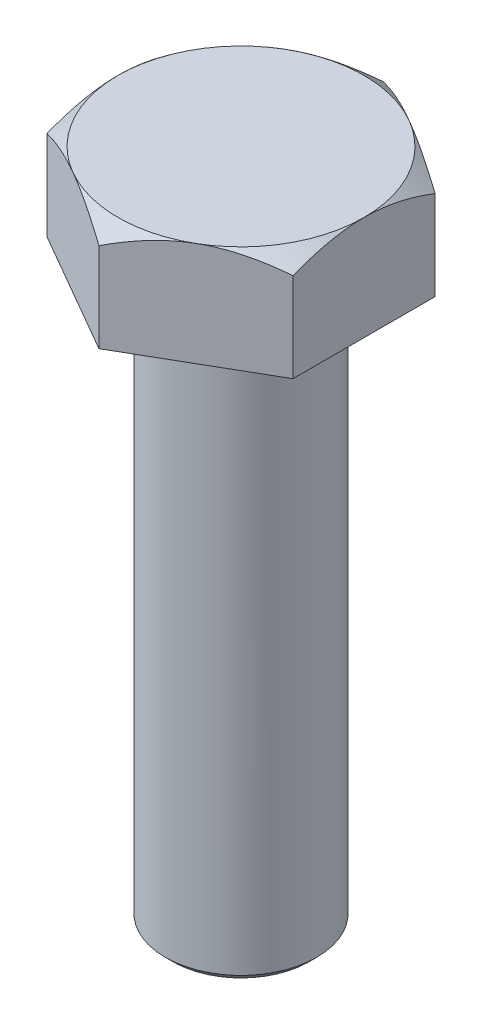
from build123d import *

# Parameters (mm, degrees)
SKETCH1_W           = 4
SKETCH1_H           = 30
BOSS_EXTRUDE1_DEPTH = 5.5
FILLET1_R           = 0.4
CHAMFER1_SIZE       = 0.4
SKETCH3_OUTSIDE_W   = 25.696
SKETCH3_OUTSIDE_H   = 27.708
SKETCH3_OUTSIDE_R   = 6.5
CUT_EXTRUDE1_DEPTH  = 1
CUT_EXTRUDE1_DRAFT  = -52


with BuildPart() as part:
    # Sketch1 → Revolve1 (revolve)
    with BuildSketch(Plane.XY, mode=Mode.PRIVATE) as revolve1_sk:
        with Locations((-2, 15)):
            Rectangle(SKETCH1_W, SKETCH1_H)
    revolve(revolve1_sk.sketch.rotate(Axis((0, 30, 0), (0, -1, 0)), 270), axis=Axis((0, 30, 0), (0, -1, 0)))

    # Sketch2 → Boss-Extrude1 (add)
    with BuildSketch(Plane(origin=(0, 30, 0), x_dir=(1, 0, 0), z_dir=(0, 1, 0))):
        Polygon((0, -7.505553499), (6.5, -3.75277675), (6.5, 3.75277675), (0, 7.505553499), (-6.5, 3.75277675), (-6.5, -3.75277675), align=None)
    extrude(amount=BOSS_EXTRUDE1_DEPTH)

    # Fillet1
    fillet1_edges = [part.edges().sort_by_distance(p)[0] for p in [
        (0, 30, -4),
    ]]
    fillet(fillet1_edges, radius=FILLET1_R)

    # Chamfer1
    chamfer1_edges = [part.edges().sort_by_distance(p)[0] for p in [
        (0, 0, -4),
    ]]
    chamfer(chamfer1_edges, length=CHAMFER1_SIZE)


with BuildPart() as cut_extrude1_tool:
    # Sketch3 outside → Cut-Extrude1 (with draft: the straight prism first)
    with BuildSketch(Plane(origin=(0, 35.5, 0), x_dir=(1, 0, 0), z_dir=(0, 1, 0))):
        Rectangle(SKETCH3_OUTSIDE_W, SKETCH3_OUTSIDE_H)
        Circle(SKETCH3_OUTSIDE_R, mode=Mode.SUBTRACT)
    extrude(amount=-CUT_EXTRUDE1_DEPTH)
    # Cut-Extrude1: the draft: its side faces are tilted about the plane it starts from
    cut_extrude1_sides = [cut_extrude1_tool.faces().sort_by_distance(p)[0] for p in [
        (0, 35, 13.854),
        (12.848, 35, 0),
        (0, 35, -13.854),
        (-12.848, 35, 0),
        (-6.5, 35, 0),
    ]]
    draft(cut_extrude1_sides, Plane(origin=(0, 35.5, 0), x_dir=(1, 0, 0), z_dir=(0, 1, 0)), CUT_EXTRUDE1_DRAFT)


with BuildPart() as part_1:
    add(part.part)

    # Cut-Extrude1: cut by cut_extrude1_tool
    add(cut_extrude1_tool.part, mode=Mode.SUBTRACT)


solid = part_1.part
